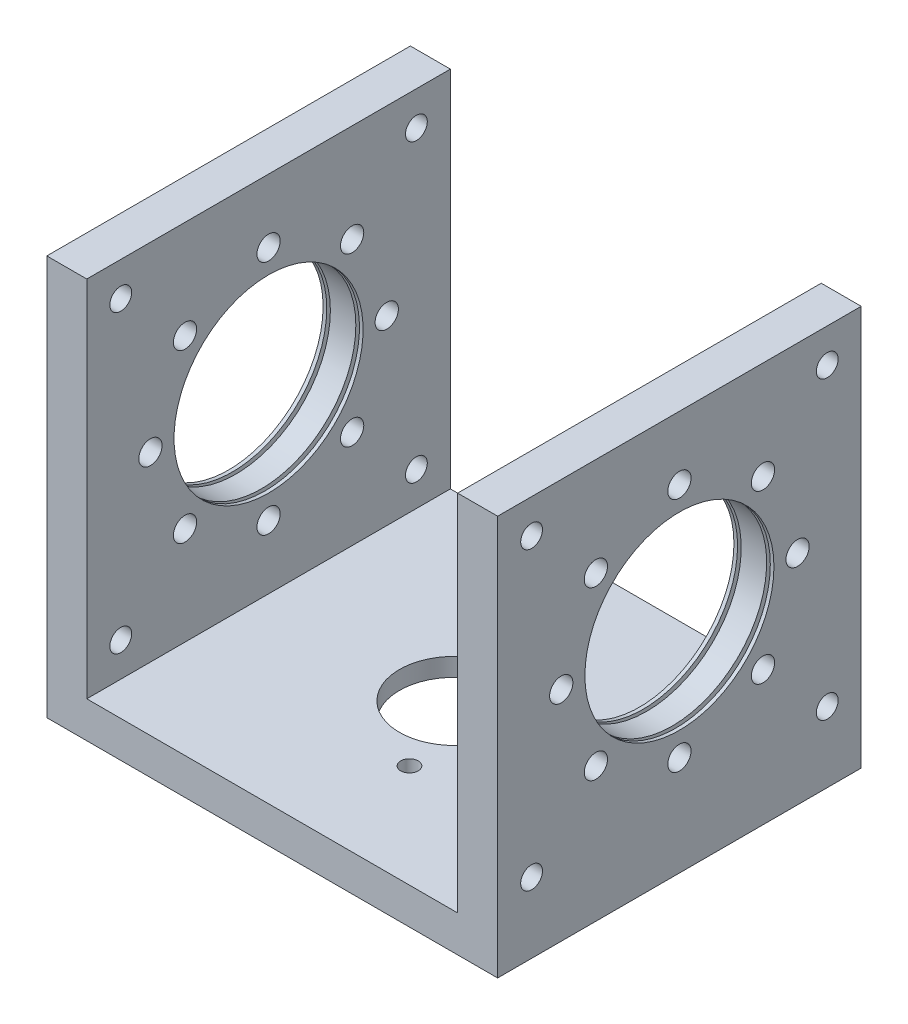
from build123d import *

# Parameters (mm, degrees)
BOSS_EXTRUDE1_DEPTH      = 100
CUT_EXTRUDE1_START       = -5
SKETCH2_R                = 41
CUT_EXTRUDE1_DEPTH       = 184.085087128
SKETCH3_R                = 15
CUT_EXTRUDE2_DEPTH       = 10
CUT_EXTRUDE3_DEPTH       = 187.732428892
CUT_EXTRUDE3_DEPTH_BACK  = 187.732428892
SKETCH4_R                = 3
M4_CLEARANCE_HOLE2_D     = 4.8
M4_CLEARANCE_HOLE2_DEPTH = 5
M4_CLEARANCE_HOLE2_TIP   = 1.442065486
SKETCH10_R               = 26
CUT_EXTRUDE5_DEPTH       = 193
M6_CLEARANCE_HOLE1_D     = 6.4
CUT_EXTRUDE6_START       = -1
SKETCH14_R               = 27.6
CUT_EXTRUDE6_DEPTH       = 1
CUT_EXTRUDE7_START       = -9
SKETCH14_2_R             = 27.6
CUT_EXTRUDE7_DEPTH       = 1
CUT_EXTRUDE8_START       = -2
SKETCH15_R               = 27.6
CUT_EXTRUDE8_DEPTH       = 1
CUT_EXTRUDE9_START       = -10
SKETCH15_2_R             = 27.6
CUT_EXTRUDE9_DEPTH       = 1


with BuildPart() as part:
    # Sketch1 → Boss-Extrude1 (new body)
    with BuildSketch(Plane.XY):
        Polygon((0, 0), (0, 110), (11, 110), (11, 10), (113, 10), (113, 110), (124, 110), (124, 0), align=None)
    extrude(amount=BOSS_EXTRUDE1_DEPTH)

    # Sketch2 → Cut-Extrude1 (cut, through all)
    with BuildSketch(Plane(origin=(0, 10, 0), x_dir=(1, 0, 0), z_dir=(0, 1, 0)).offset(CUT_EXTRUDE1_START)):
        with Locations((62, -50)):
            Circle(SKETCH2_R)
    extrude(amount=-CUT_EXTRUDE1_DEPTH, mode=Mode.SUBTRACT)

    # Sketch3 → Cut-Extrude2 (cut)
    with BuildSketch(Plane.XZ.offset(-5)):
        with Locations((62, 50)):
            Circle(SKETCH3_R)
    extrude(amount=-CUT_EXTRUDE2_DEPTH, mode=Mode.SUBTRACT)

    # Sketch4 → Cut-Extrude3 (cut, two sides: drawn at the far end of the back side and taken through both)
    with BuildSketch(Plane(origin=(11, 0, 0), x_dir=(0, 0, -1), z_dir=(1, 0, 0)).offset(-CUT_EXTRUDE3_DEPTH_BACK)):
        with Locations((-9.341360082, 100.658639918)):
            Circle(SKETCH4_R)
        with Locations((-9.341360082, 19.341360082)):
            Circle(SKETCH4_R)
        with Locations((-90.658639918, 19.341360082)):
            Circle(SKETCH4_R)
        with Locations((-90.658639918, 100.658639918)):
            Circle(SKETCH4_R)
    extrude(amount=CUT_EXTRUDE3_DEPTH + CUT_EXTRUDE3_DEPTH_BACK, mode=Mode.SUBTRACT)

    # M4 Clearance Hole2
    with Locations(Plane(origin=(0, 10, 0), x_dir=(1, 0, 0), z_dir=(0, 1, 0))):
        with Locations((69.403965408, -30.348503969), (91, -50), (71.348503969, -71.596034592), (49.752469377, -51.944538562)):
            Hole(M4_CLEARANCE_HOLE2_D / 2, depth=M4_CLEARANCE_HOLE2_DEPTH)
            with Locations((0, 0, -(M4_CLEARANCE_HOLE2_DEPTH + M4_CLEARANCE_HOLE2_TIP / 2))):  # 118° drill point
                Cone(0, M4_CLEARANCE_HOLE2_D / 2, M4_CLEARANCE_HOLE2_TIP, mode=Mode.SUBTRACT)

    # Sketch10 → Cut-Extrude5 (cut)
    with BuildSketch(Plane(origin=(124, 0, 0), x_dir=(0, 0, -1), z_dir=(1, 0, 0))):
        with Locations((-50, 60)):
            Circle(SKETCH10_R)
    extrude(amount=-CUT_EXTRUDE5_DEPTH, mode=Mode.SUBTRACT)

    # M6 Clearance Hole1 (through all)
    with Locations(Plane(origin=(124, 0, 0), x_dir=(0, 0, -1), z_dir=(1, 0, 0))):
        with Locations((-72.980970389, 82.980970389), (-50, 92.5), (-27.019029611, 82.980970389), (-17.5, 60), (-27.019029611, 37.019029611), (-50, 27.5), (-72.980970389, 37.019029611), (-82.5, 60)):
            Hole(M6_CLEARANCE_HOLE1_D / 2)

    # Sketch14 → Cut-Extrude6 (cut)
    with BuildSketch(Plane(origin=(124, 0, 0), x_dir=(0, 0, -1), z_dir=(1, 0, 0)).offset(CUT_EXTRUDE6_START)):
        with Locations((-50, 60)):
            Circle(SKETCH14_R)
    extrude(amount=-CUT_EXTRUDE6_DEPTH, mode=Mode.SUBTRACT)

    # Sketch14<2> → Cut-Extrude7 (cut)
    with BuildSketch(Plane(origin=(124, 0, 0), x_dir=(0, 0, -1), z_dir=(1, 0, 0)).offset(CUT_EXTRUDE7_START)):
        with Locations((-50, 60)):
            Circle(SKETCH14_2_R)
    extrude(amount=-CUT_EXTRUDE7_DEPTH, mode=Mode.SUBTRACT)

    # Sketch15 → Cut-Extrude8 (cut)
    with BuildSketch(Plane.ZY.offset(CUT_EXTRUDE8_START)):
        with Locations((50, 60)):
            Circle(SKETCH15_R)
    extrude(amount=CUT_EXTRUDE8_DEPTH, mode=Mode.SUBTRACT)

    # Sketch15<2> → Cut-Extrude9 (cut)
    with BuildSketch(Plane.ZY.offset(CUT_EXTRUDE9_START)):
        with Locations((50, 60)):
            Circle(SKETCH15_2_R)
    extrude(amount=CUT_EXTRUDE9_DEPTH, mode=Mode.SUBTRACT)


solid = part.part
